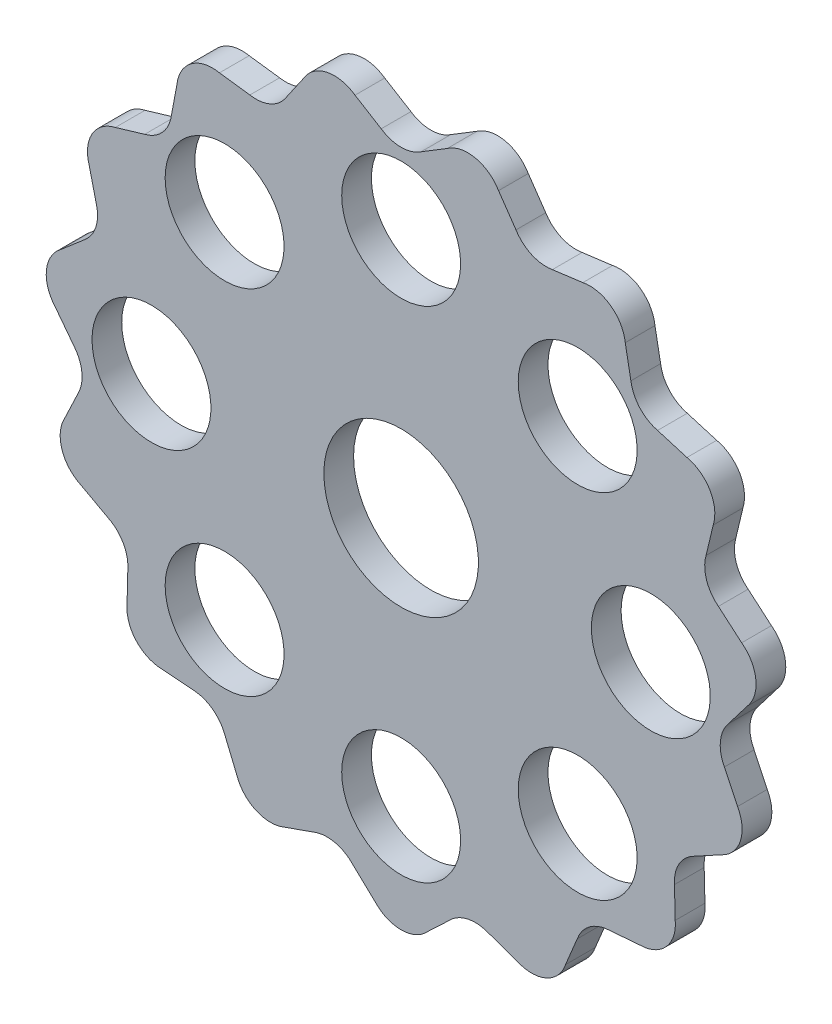
from build123d import *

# Parameters (mm, degrees)
BOSS_EXTRU_1_DEPTH      = 5
ESQUISSE2_R             = 13
ESQUISSE2_R_2           = 10
ENL_V_MAT_EXTRU_1_DEPTH = 85.791446444


with BuildPart() as part:
    # Esquisse1 → Boss.-Extru.1 (new body)
    with BuildSketch(Plane.XY):
        with BuildLine():
            Line((-7.756063007, 57.713945373), (-3.353460657, 55.024630504))
            ThreePointArc((-3.353460657, 55.024630504), (0, 54), (3.353460657, 55.024630504))
            Line((3.353460657, 55.024630504), (7.756063007, 57.713945373))
            ThreePointArc((7.756063007, 57.713945373), (10.013220978, 58.695868578), (12.474701449, 58.688856044))
            ThreePointArc((12.474701449, 58.688856044), (14.726228007, 57.694088008), (16.388860271, 55.878987669))
            Line((16.388860271, 55.878987669), (19.316994747, 51.631476586))
            ThreePointArc((19.316994747, 51.631476586), (21.963778726, 49.331454713), (25.444072249, 48.903525925))
            Line((25.444072249, 48.903525925), (30.559892529, 49.569637607))
            ThreePointArc((30.559892529, 49.569637607), (33.021293088, 49.548600235), (35.267115138, 48.541019662))
            ThreePointArc((35.267115138, 48.541019662), (36.919378386, 46.716475488), (37.700000719, 44.382045352))
            Line((37.700000719, 44.382045352), (38.64736627, 39.310771309))
            ThreePointArc((38.64736627, 39.310771309), (40.129820576, 36.133052743), (43.135172596, 34.326557439))
            Line((43.135172596, 34.326557439), (48.079639004, 32.854289173))
            ThreePointArc((48.079639004, 32.854289173), (50.319683635, 31.833928776), (51.961524227, 30))
            ThreePointArc((51.961524227, 30), (52.72883284, 27.66115995), (52.49246855, 25.211044196))
            Line((52.49246855, 25.211044196), (51.295257065, 20.192876545))
            ThreePointArc((51.295257065, 20.192876545), (51.35705188, 16.686917696), (53.367809731, 13.814215325))
            Line((53.367809731, 13.814215325), (57.285979107, 10.45813567))
            ThreePointArc((57.285979107, 10.45813567), (58.917343741, 8.61488183), (59.671313722, 6.271707796))
            ThreePointArc((59.671313722, 6.271707796), (59.420993069, 3.822978563), (58.208511689, 1.680824463))
            Line((58.208511689, 1.680824463), (55.07373191, -2.416550019))
            ThreePointArc((55.07373191, -2.416550019), (53.70418235, -5.644537016), (54.372667732, -9.086730118))
            Line((54.372667732, -9.086730118), (56.587052995, -13.746324501))
            ThreePointArc((56.587052995, -13.746324501), (57.327659867, -16.093756448), (57.063390978, -18.541019662))
            ThreePointArc((57.063390978, -18.541019662), (55.838723774, -20.676230548), (53.859774349, -22.14002509))
            Line((53.859774349, -22.14002509), (49.329458179, -24.608133132))
            ThreePointArc((49.329458179, -24.608133132), (46.765371804, -27), (45.975997522, -30.416497372))
            Line((45.975997522, -30.416497372), (46.103711342, -35.573920284))
            ThreePointArc((46.103711342, -35.573920284), (45.825502796, -38.019638029), (44.588689529, -40.147836382))
            ThreePointArc((44.588689529, -40.147836382), (42.60143186, -41.60033156), (40.198192724, -42.132663168))
            Line((40.198192724, -42.132663168), (35.055672985, -42.544746469))
            ThreePointArc((35.055672985, -42.544746469), (31.740403624, -43.686917696), (29.629659661, -46.486975906))
            Line((29.629659661, -46.486975906), (27.64861916, -51.25046207))
            ThreePointArc((27.64861916, -51.25046207), (26.399699981, -53.371578798), (24.404198585, -54.812727459))
            ThreePointArc((24.404198585, -54.812727459), (21.997965355, -55.331357318), (19.585978387, -54.840181022))
            Line((19.585978387, -54.840181022), (14.720443461, -53.124986634))
            ThreePointArc((14.720443461, -53.124986634), (11.227231304, -52.81997044), (8.160084469, -54.519433984))
            Line((8.160084469, -54.519433984), (4.412829545, -58.065333369))
            ThreePointArc((4.412829545, -58.065333369), (2.409149205, -59.495088726), (0, -60))
            ThreePointArc((0, -60), (-2.409149205, -59.495088726), (-4.412829545, -58.065333369))
            Line((-4.412829545, -58.065333369), (-8.160084469, -54.519433984))
            ThreePointArc((-8.160084469, -54.519433984), (-11.227231304, -52.81997044), (-14.720443461, -53.124986634))
            Line((-14.720443461, -53.124986634), (-19.585978387, -54.840181022))
            ThreePointArc((-19.585978387, -54.840181022), (-21.997965355, -55.331357318), (-24.404198585, -54.812727459))
            ThreePointArc((-24.404198585, -54.812727459), (-26.399699981, -53.371578798), (-27.64861916, -51.25046207))
            Line((-27.64861916, -51.25046207), (-29.629659661, -46.486975906))
            ThreePointArc((-29.629659661, -46.486975906), (-31.740403624, -43.686917696), (-35.055672985, -42.544746469))
            Line((-35.055672985, -42.544746469), (-40.198192724, -42.132663168))
            ThreePointArc((-40.198192724, -42.132663168), (-42.60143186, -41.60033156), (-44.588689529, -40.147836382))
            ThreePointArc((-44.588689529, -40.147836382), (-45.825502796, -38.019638029), (-46.103711342, -35.573920284))
            Line((-46.103711342, -35.573920284), (-45.975997522, -30.416497372))
            ThreePointArc((-45.975997522, -30.416497372), (-46.765371804, -27), (-49.329458179, -24.608133132))
            Line((-49.329458179, -24.608133132), (-53.859774349, -22.14002509))
            ThreePointArc((-53.859774349, -22.14002509), (-55.838723774, -20.676230548), (-57.063390978, -18.541019662))
            ThreePointArc((-57.063390978, -18.541019662), (-57.327659867, -16.093756448), (-56.587052995, -13.746324501))
            Line((-56.587052995, -13.746324501), (-54.372667732, -9.086730118))
            ThreePointArc((-54.372667732, -9.086730118), (-53.70418235, -5.644537016), (-55.07373191, -2.416550019))
            Line((-55.07373191, -2.416550019), (-58.208511689, 1.680824463))
            ThreePointArc((-58.208511689, 1.680824463), (-59.420993069, 3.822978563), (-59.671313722, 6.271707796))
            ThreePointArc((-59.671313722, 6.271707796), (-58.917343741, 8.61488183), (-57.285979107, 10.45813567))
            Line((-57.285979107, 10.45813567), (-53.367809731, 13.814215325))
            ThreePointArc((-53.367809731, 13.814215325), (-51.35705188, 16.686917696), (-51.295257065, 20.192876545))
            Line((-51.295257065, 20.192876545), (-52.49246855, 25.211044196))
            ThreePointArc((-52.49246855, 25.211044196), (-52.72883284, 27.66115995), (-51.961524227, 30))
            ThreePointArc((-51.961524227, 30), (-50.319683635, 31.833928776), (-48.079639004, 32.854289173))
            Line((-48.079639004, 32.854289173), (-43.135172596, 34.326557439))
            ThreePointArc((-43.135172596, 34.326557439), (-40.129820576, 36.133052743), (-38.64736627, 39.310771309))
            Line((-38.64736627, 39.310771309), (-37.700000719, 44.382045352))
            ThreePointArc((-37.700000719, 44.382045352), (-36.919378386, 46.716475488), (-35.267115138, 48.541019662))
            ThreePointArc((-35.267115138, 48.541019662), (-33.021293088, 49.548600235), (-30.559892529, 49.569637607))
            Line((-30.559892529, 49.569637607), (-25.444072249, 48.903525925))
            ThreePointArc((-25.444072249, 48.903525925), (-21.963778726, 49.331454713), (-19.316994747, 51.631476586))
            Line((-19.316994747, 51.631476586), (-16.388860271, 55.878987669))
            ThreePointArc((-16.388860271, 55.878987669), (-14.726228007, 57.694088008), (-12.474701449, 58.688856044))
            ThreePointArc((-12.474701449, 58.688856044), (-10.013220978, 58.695868578), (-7.756063007, 57.713945373))
        make_face()
    extrude(amount=BOSS_EXTRU_1_DEPTH)

    # Esquisse2 → Enlèv. mat.-Extru.1 (cut, through all)
    with BuildSketch(Plane(origin=(0, 0, 0), x_dir=(-1, 0, 0), z_dir=(0, 0, -1))):
        Circle(ESQUISSE2_R)
        with Locations((0, 42)):
            Circle(ESQUISSE2_R_2)
        with Locations((29.69848481, 29.69848481)):
            Circle(ESQUISSE2_R_2)
        with Locations((42, 0)):
            Circle(ESQUISSE2_R_2)
        with Locations((29.69848481, -29.69848481)):
            Circle(ESQUISSE2_R_2)
        with Locations((0, -42)):
            Circle(ESQUISSE2_R_2)
        with Locations((-29.69848481, -29.69848481)):
            Circle(ESQUISSE2_R_2)
        with Locations((-42, 0)):
            Circle(ESQUISSE2_R_2)
        with Locations((-29.69848481, 29.69848481)):
            Circle(ESQUISSE2_R_2)
    extrude(amount=-ENL_V_MAT_EXTRU_1_DEPTH, mode=Mode.SUBTRACT)


solid = part.part
